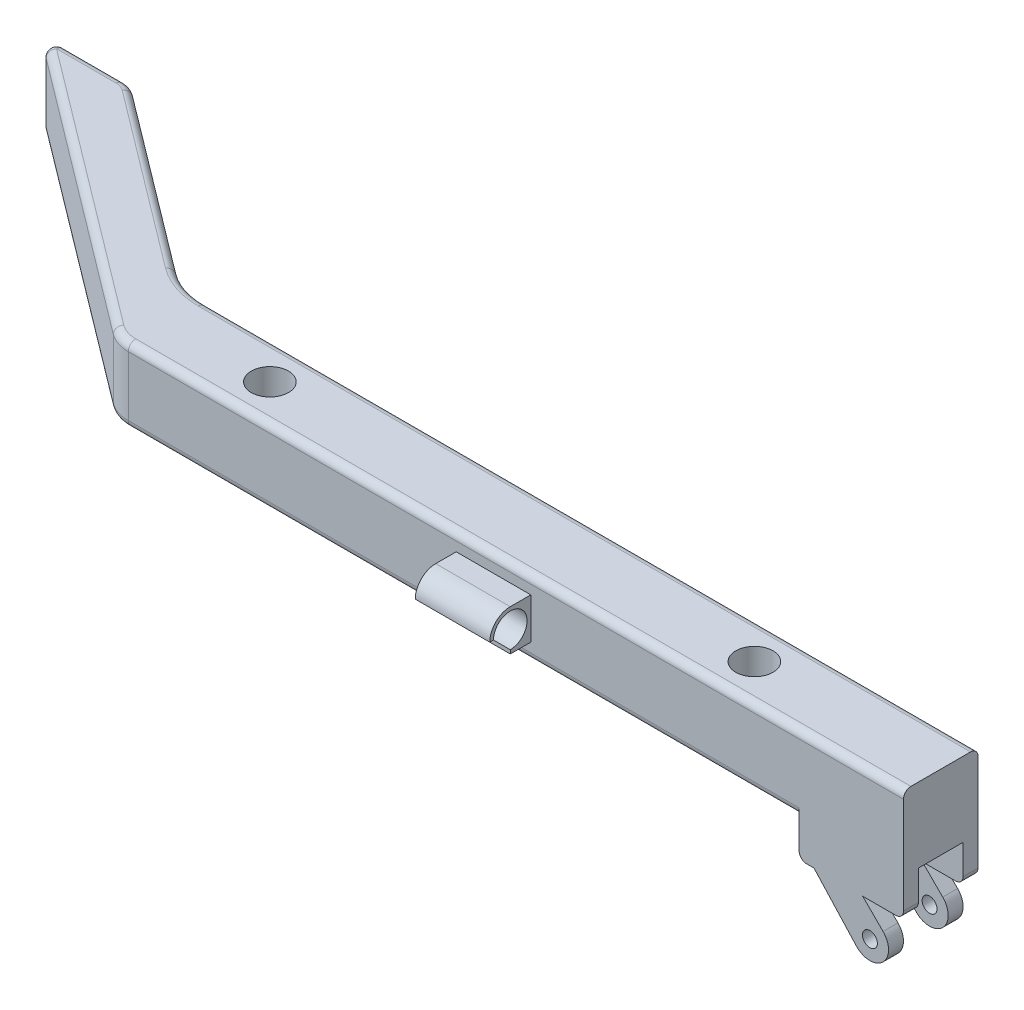
from build123d import *

# Parameters (mm, degrees)
BOSS_EXTRUDE2_DEPTH = 5
BOSS_EXTRUDE3_DEPTH = 2
SKETCH4_R           = 1
CUT_EXTRUDE1_DEPTH  = 96.580030811
FILLET1_R           = 1
FILLET2_R           = 1
SKETCH5_R           = 2.5
CUT_EXTRUDE2_DEPTH  = 97.594732206
BOSS_EXTRUDE4_DEPTH = 5


with BuildPart() as part:
    # Sketch1 → Boss-Extrude2 (new, symmetric)
    with BuildSketch(Plane(origin=(0, 0, 0), x_dir=(1, 0, 0), z_dir=(0, 1, 0))):
        with BuildLine():
            Line((-49, 0), (49, 0))
            Line((49, 0), (55, 0))
            Line((55, 0), (55, 10))
            Line((55, 10), (49, 10))
            Line((49, 10), (-48.597064799, 10))
            ThreePointArc((-48.597064799, 10), (-51.770174838, 10.516784686), (-54.615321941, 12.013725463))
            Line((-54.615321941, 12.013725463), (-78.198331144, 29.785292532))
            ThreePointArc((-78.198331144, 29.785292532), (-79.051875275, 30.234374765), (-80.003808287, 30.389410171))
            Line((-80.003808287, 30.389410171), (-88.011381516, 30.389410171))
            ThreePointArc((-88.011381516, 30.389410171), (-88.959703047, 29.706721175), (-88.61320723, 28.590782717))
            Line((-88.61320723, 28.590782717), (-52.009128571, 1.006862732))
            ThreePointArc((-52.009128571, 1.006862732), (-50.586555019, 0.258392343), (-49, 0))
        make_face()
    extrude(amount=BOSS_EXTRUDE2_DEPTH, both=True)

    # Sketch3 → Boss-Extrude3 (add)
    with BuildSketch(Plane.XY):
        Polygon((55, -5), (41, -5), (41, -10), (43, -10), (43, -17), (53, -17), (53, -10), (55, -10), align=None)
    boss_extrude3 = extrude(amount=-BOSS_EXTRUDE3_DEPTH)

    # Sketch4 → Cut-Extrude1 (cut, through all)
    with BuildSketch(Plane.XY):
        with BuildLine():
            Line((55, -10), (55, -9))
            ThreePointArc((55, -9), (54.707106781, -9.707106781), (54, -10))
            Line((54, -10), (55, -10))
        make_face()
        with BuildLine():
            Line((53, -14.5), (53, -10))
            Line((53, -10), (49.535533906, -10))
            Line((49.535533906, -10), (52.267766953, -12.732233047))
            ThreePointArc((52.267766953, -12.732233047), (52.809698831, -13.543291419), (53, -14.5))
        make_face()
        with BuildLine():
            Line((53, -17), (53, -14.5))
            ThreePointArc((53, -14.5), (52.267766953, -16.267766953), (50.5, -17))
            Line((50.5, -17), (53, -17))
        make_face()
        with BuildLine():
            ThreePointArc((42, -10), (41.292893219, -9.707106781), (41, -9))
            Line((41, -9), (41, -10))
            Line((41, -10), (42, -10))
        make_face()
        with BuildLine():
            Line((43, -17), (50.5, -17))
            ThreePointArc((50.5, -17), (49.441268366, -16.764748844), (48.581791004, -16.103269862))
            Line((48.581791004, -16.103269862), (43, -10))
            Line((43, -10), (43, -17))
        make_face()
        with Locations((50.5, -14.5)):
            Circle(SKETCH4_R)
    cut_extrude1 = extrude(amount=-CUT_EXTRUDE1_DEPTH, mode=Mode.SUBTRACT)

    # Mirror1: Boss-Extrude3, Cut-Extrude1 across plane
    add(boss_extrude3.mirror(Plane.XY.offset(-5)))
    add(cut_extrude1.mirror(Plane.XY.offset(-5)), mode=Mode.SUBTRACT)

    # Fillet1
    fillet1_edges = [part.edges().sort_by_distance(p)[0] for p in [
        (-4, -5, 0),
        (-50.586555019, -5, -0.258392343),
        (-70.3111679, -5, -14.798822724),
        (-88.959703047, -5, -29.706721175),
        (-84.007594901, -5, -30.389410171),
        (-79.051875275, -5, -30.234374765),
        (-66.406826543, -5, -20.899508998),
        (-3.7985324, -5, -10),
        (-51.770174838, -5, -10.516784686),
    ]]
    fillet(fillet1_edges, radius=FILLET1_R)

    # Fillet2
    fillet2_edges = [part.edges().sort_by_distance(p)[0] for p in [
        (3.2014676, 5, -10),
        (-51.770174838, 5, -10.516784686),
        (-66.406826543, 5, -20.899508998),
        (-79.051875275, 5, -30.234374765),
        (-84.007594901, 5, -30.389410171),
        (-88.959703047, 5, -29.706721175),
        (-70.3111679, 5, -14.798822724),
        (-50.586555019, 5, -0.258392343),
        (3, 5, 0),
    ]]
    fillet(fillet2_edges, radius=FILLET2_R)

    # Sketch5 → Cut-Extrude2 (cut, through all)
    with BuildSketch(Plane(origin=(0, 5, 0), x_dir=(1, 0, 0), z_dir=(0, 1, 0))):
        with Locations(Location((30, 5, 0), (0, 0, 270))):
            Circle(SKETCH5_R)
        with Locations(Location((-35, 5, 0), (0, 0, 270))):
            Circle(SKETCH5_R)
    extrude(amount=-CUT_EXTRUDE2_DEPTH, mode=Mode.SUBTRACT)

    # Sketch6 → Boss-Extrude4 (add, symmetric)
    with BuildSketch(Plane(origin=(0, 0, 0), x_dir=(0, 0, -1), z_dir=(1, 0, 0))):
        with BuildLine():
            Line((0, 2.75), (0, -2.75))
            Line((0, -2.75), (-2.75, -2.75))
            Line((-2.75, -2.75), (-2.75, -2.25))
            ThreePointArc((-2.75, -2.25), (-0.5, 0), (-2.75, 2.25))
            ThreePointArc((-2.75, 2.25), (-4.340990258, 1.590990258), (-5, 0))
            Line((-5, 0), (-5.5, 0))
            ThreePointArc((-5.5, 0), (-4.694543648, 1.944543648), (-2.75, 2.75))
            Line((-2.75, 2.75), (0, 2.75))
        make_face()
    extrude(amount=BOSS_EXTRUDE4_DEPTH, both=True)


solid = part.part
